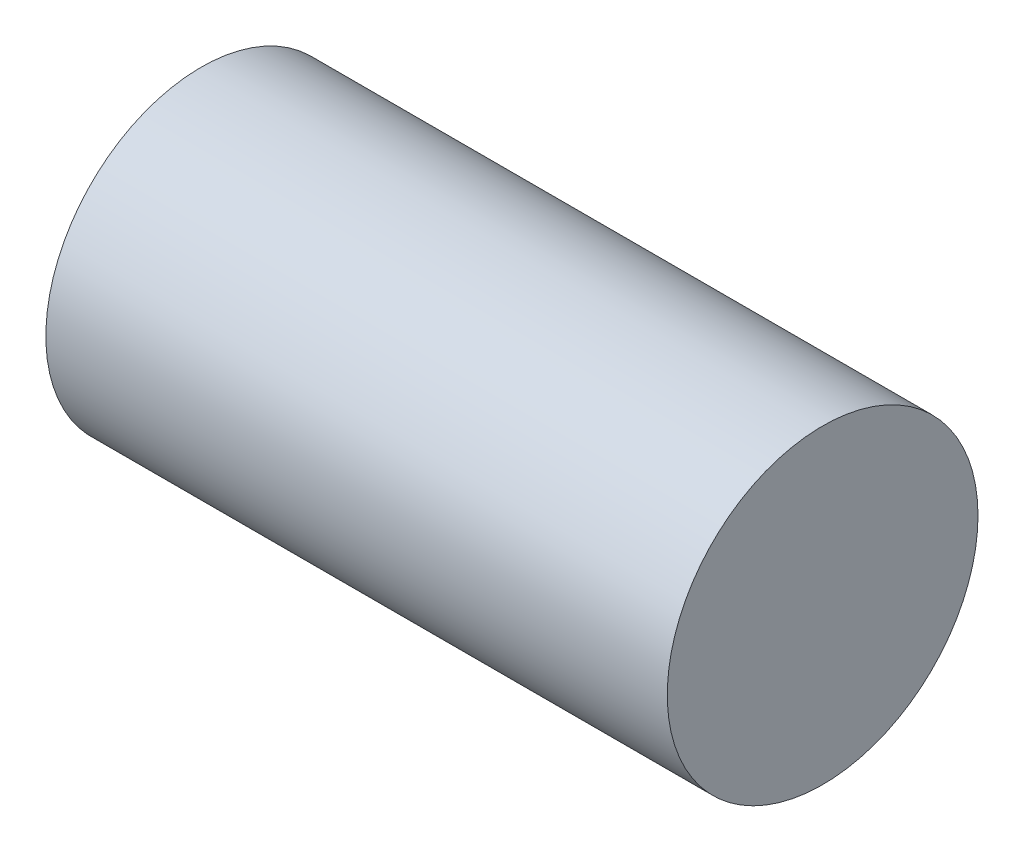
from build123d import *

# Parameters (mm, degrees)
SKETCH2_R           = 6.35
BOSS_EXTRUDE1_DEPTH = 25.4


with BuildPart() as part:
    # Sketch2 → Boss-Extrude1 (new body)
    with BuildSketch(Plane(origin=(0, 0, 0), x_dir=(0, 0, -1), z_dir=(1, 0, 0))):
        Circle(SKETCH2_R)
    extrude(amount=BOSS_EXTRUDE1_DEPTH)


solid = part.part
